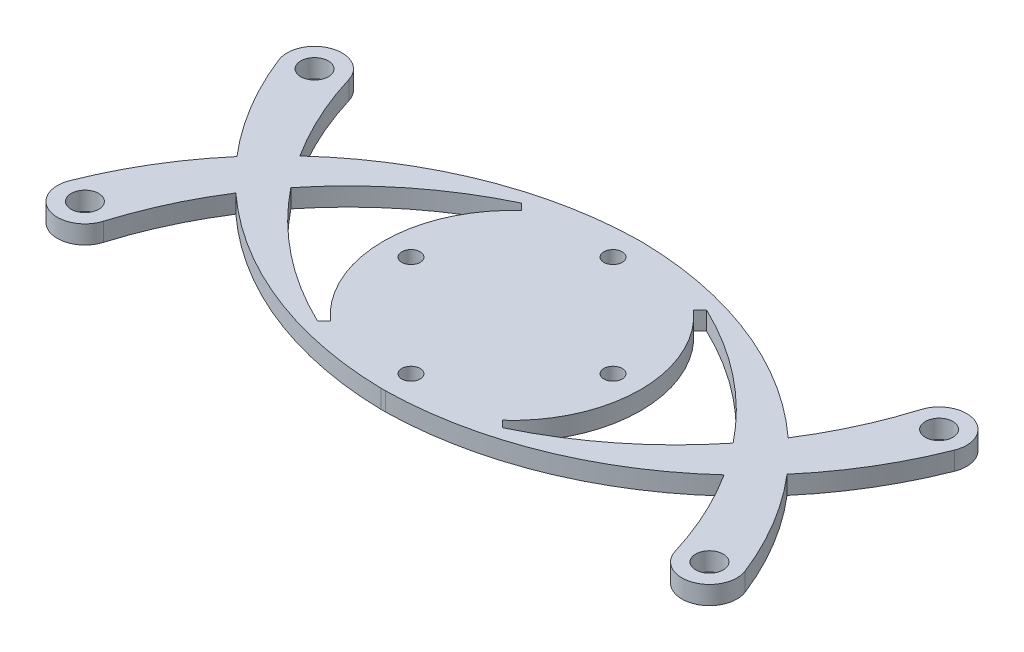
from build123d import *

# Parameters (mm, degrees)
SKETCH_1_R          = 1.5
SKETCH_1_R_2        = 1
EXTRUDE_1_DEPTH     = 2
CUT_EXTRUDE_START   = -10
CUT_EXTRUDE_1_DEPTH = 10
EXTRUDE_START       = -2
EXTRUDE_2_DEPTH     = 2


with BuildPart() as part:
    # 草图1 → 凸台-拉伸1 (new body)
    with BuildSketch(Plane(origin=(0, 0, 0), x_dir=(1, 0, 0), z_dir=(0, 1, 0))):
        with BuildLine():
            Line((-35, 15.5), (35, 15.5))
            ThreePointArc((35, 15.5), (36.414213562, 14.914213562), (37, 13.5))
            Line((37, 13.5), (37, -13.5))
            ThreePointArc((37, -13.5), (36.414213562, -14.914213562), (35, -15.5))
            Line((35, -15.5), (-35, -15.5))
            ThreePointArc((-35, -15.5), (-36.414213562, -14.914213562), (-37, -13.5))
            Line((-37, -13.5), (-37, 13.5))
            ThreePointArc((-37, 13.5), (-36.414213562, 14.914213562), (-35, 15.5))
        make_face()
        with Locations((-34, 12.5)):
            Circle(SKETCH_1_R, mode=Mode.SUBTRACT)
        with Locations((-34, -12.5)):
            Circle(SKETCH_1_R, mode=Mode.SUBTRACT)
        with Locations((34, 12.5)):
            Circle(SKETCH_1_R, mode=Mode.SUBTRACT)
        with Locations((34, -12.5)):
            Circle(SKETCH_1_R, mode=Mode.SUBTRACT)
        with Locations((0, 11)):
            Circle(SKETCH_1_R_2, mode=Mode.SUBTRACT)
        with Locations((-11, 0)):
            Circle(SKETCH_1_R_2, mode=Mode.SUBTRACT)
        with Locations((0, -11)):
            Circle(SKETCH_1_R_2, mode=Mode.SUBTRACT)
        with Locations((11, 0)):
            Circle(SKETCH_1_R_2, mode=Mode.SUBTRACT)
    extrude(amount=EXTRUDE_1_DEPTH)

    # 草图2 → 切除-拉伸1 (cut)
    with BuildSketch(Plane(origin=(0, 2, 0), x_dir=(1, 0, 0), z_dir=(0, 1, 0)).offset(CUT_EXTRUDE_START)):
        with BuildLine():
            ThreePointArc((37, 13.5), (36.414213562, 14.914213562), (35, 15.5))
            Line((35, 15.5), (34, 15.5))
            ThreePointArc((34, 15.5), (36.121320344, 14.621320344), (37, 12.5))
            Line((37, 12.5), (37, 13.5))
        make_face()
        with BuildLine():
            ThreePointArc((31.129544421, 13.372057779), (32.21340734, 14.909997234), (34, 15.5))
            Line((34, 15.5), (-34.000000062, 15.5))
            ThreePointArc((-34.000000062, 15.5), (-32.213407365, 14.909997253), (-31.129544421, 13.372057779))
            ThreePointArc((-31.129544421, 13.372057779), (-29.192502027, 8.274752588), (-26.580191252, 3.488262657))
            ThreePointArc((-26.580191252, 3.488262657), (-14.374020851, 11.15529545), (-0.242721863, 13.997895774))
            ThreePointArc((-0.242721863, 13.997895774), (0, 14), (0.242721863, 13.997895774))
            ThreePointArc((0.242721863, 13.997895774), (14.374020851, 11.15529545), (26.580191252, 3.488262657))
            ThreePointArc((26.580191252, 3.488262657), (29.192502027, 8.274752588), (31.129544421, 13.372057779))
        make_face()
        with BuildLine():
            ThreePointArc((-37, 12.5), (-36.121320365, 14.621320322), (-34.000000062, 15.5))
            Line((-34.000000062, 15.5), (-35, 15.5))
            ThreePointArc((-35, 15.5), (-36.414213562, 14.914213562), (-37, 13.5))
            Line((-37, 13.5), (-37, 12.5))
        make_face()
        with BuildLine():
            Line((37, -12.5), (37, 12.5))
            ThreePointArc((37, 12.5), (36.947873541, 11.943186219), (36.793305609, 11.405722258))
            ThreePointArc((36.793305609, 11.405722258), (33.849039363, 5.416414449), (29.949941227, 0))
            ThreePointArc((29.949941227, 0), (33.849039363, -5.416414449), (36.793305609, -11.405722258))
            ThreePointArc((36.793305609, -11.405722258), (36.947873541, -11.943186219), (37, -12.5))
        make_face()
        with BuildLine():
            ThreePointArc((-36.793305609, 11.405722258), (-36.947873541, 11.943186219), (-37, 12.5))
            Line((-37, 12.5), (-37, -12.5))
            ThreePointArc((-37, -12.5), (-36.947873541, -11.943186219), (-36.793305609, -11.405722258))
            ThreePointArc((-36.793305609, -11.405722258), (-33.849039363, -5.416414449), (-29.949941227, 0))
            ThreePointArc((-29.949941227, 0), (-33.849039363, 5.416414449), (-36.793305609, 11.405722258))
        make_face()
        with BuildLine():
            Line((37, -13.5), (37, -12.5))
            ThreePointArc((37, -12.5), (36.121320344, -14.621320344), (34, -15.5))
            Line((34, -15.5), (35, -15.5))
            ThreePointArc((35, -15.5), (36.414213562, -14.914213562), (37, -13.5))
        make_face()
        with BuildLine():
            ThreePointArc((-34, -15.5), (-36.121320344, -14.621320344), (-37, -12.5))
            Line((-37, -12.5), (-37, -13.5))
            ThreePointArc((-37, -13.5), (-36.414213562, -14.914213562), (-35, -15.5))
            Line((-35, -15.5), (-34, -15.5))
        make_face()
        with BuildLine():
            Line((-34, -15.5), (34, -15.5))
            ThreePointArc((34, -15.5), (32.21340734, -14.909997234), (31.129544421, -13.372057779))
            ThreePointArc((31.129544421, -13.372057779), (29.192502027, -8.274752588), (26.580191252, -3.488262657))
            ThreePointArc((26.580191252, -3.488262657), (14.374020851, -11.15529545), (0.242721863, -13.997895774))
            ThreePointArc((0.242721863, -13.997895774), (0, -14), (-0.242721863, -13.997895774))
            ThreePointArc((-0.242721863, -13.997895774), (-14.374020851, -11.15529545), (-26.580191252, -3.488262657))
            ThreePointArc((-26.580191252, -3.488262657), (-29.192502027, -8.274752588), (-31.129544421, -13.372057779))
            ThreePointArc((-31.129544421, -13.372057779), (-32.21340734, -14.909997234), (-34, -15.5))
        make_face()
        with BuildLine():
            ThreePointArc((24.082197813, 0), (15.011406824, 8.30476234), (3.846336647, 13.461266449))
            ThreePointArc((3.846336647, 13.461266449), (14, 0), (3.846336647, -13.461266449))
            ThreePointArc((3.846336647, -13.461266449), (15.011406824, -8.30476234), (24.082197813, 0))
        make_face()
        with BuildLine():
            ThreePointArc((-3.846336647, -13.461266449), (-14, 0), (-3.846336647, 13.461266449))
            ThreePointArc((-3.846336647, 13.461266449), (-15.011406824, 8.30476234), (-24.082197813, 0))
            ThreePointArc((-24.082197813, 0), (-15.011406824, -8.30476234), (-3.846336647, -13.461266449))
        make_face()
    extrude(amount=CUT_EXTRUDE_1_DEPTH, mode=Mode.SUBTRACT)

    # 草图3 → 凸台-拉伸2 (add)
    with BuildSketch(Plane(origin=(0, 2, 0), x_dir=(1, 0, 0), z_dir=(0, 1, 0)).offset(EXTRUDE_START)):
        with BuildLine():
            Line((-10.083439521, 11.100962324), (-9.356776872, 10.413967859))
            ThreePointArc((-9.356776872, 10.413967859), (-6.775105817, 12.251446493), (-3.846336647, 13.461266449))
            ThreePointArc((-3.846336647, 13.461266449), (-7.014162346, 12.411321608), (-10.083439521, 11.100962324))
        make_face()
        with BuildLine():
            Line((10.083439521, 11.100962324), (9.356776872, 10.413967859))
            ThreePointArc((9.356776872, 10.413967859), (6.775105817, 12.251446493), (3.846336647, 13.461266449))
            ThreePointArc((3.846336647, 13.461266449), (7.014162346, 12.411321608), (10.083439521, 11.100962324))
        make_face()
        with BuildLine():
            Line((-10.083439521, -11.100962324), (-9.356776872, -10.413967859))
            ThreePointArc((-9.356776872, -10.413967859), (-6.775105817, -12.251446493), (-3.846336647, -13.461266449))
            ThreePointArc((-3.846336647, -13.461266449), (-7.014162346, -12.411321608), (-10.083439521, -11.100962324))
        make_face()
        with BuildLine():
            Line((10.083439521, -11.100962324), (9.356776872, -10.413967859))
            ThreePointArc((9.356776872, -10.413967859), (6.775105817, -12.251446493), (3.846336647, -13.461266449))
            ThreePointArc((3.846336647, -13.461266449), (7.014162346, -12.411321608), (10.083439521, -11.100962324))
        make_face()
    extrude(amount=EXTRUDE_2_DEPTH)


solid = part.part
